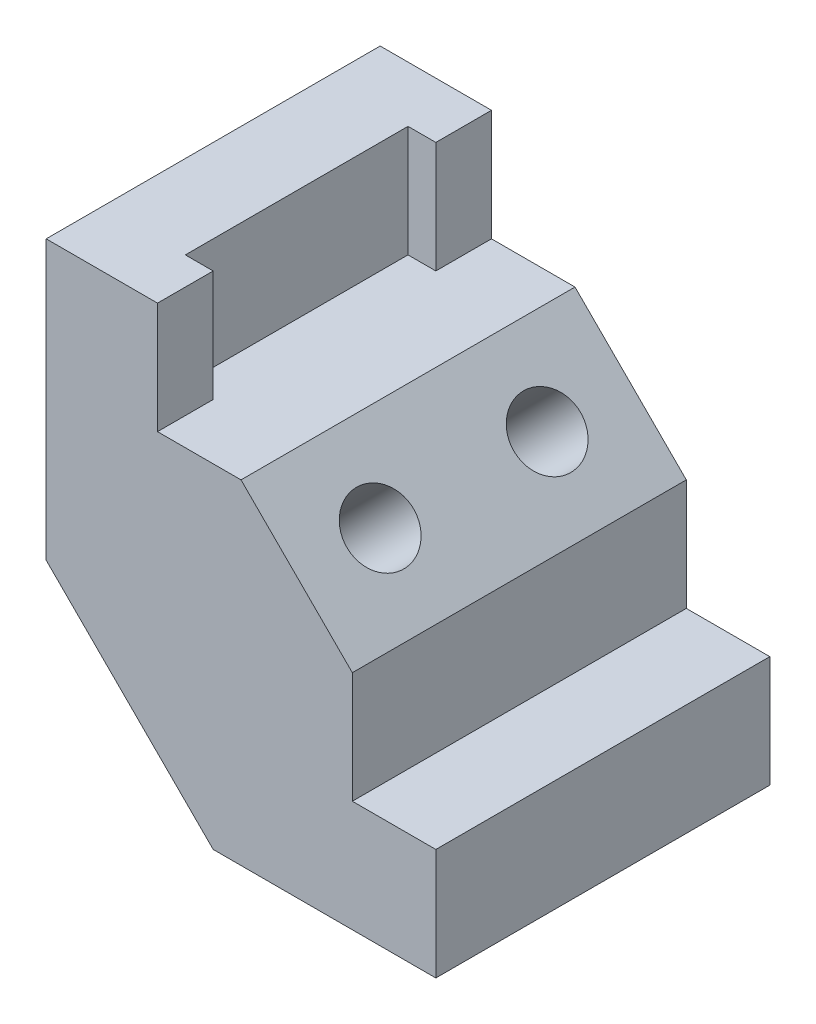
from build123d import *

# Parameters (mm, degrees)
BOSS_EXTRUDE2_DEPTH = 38.1
SKETCH7_W           = 6.35
SKETCH7_H           = 50.8
CUT_EXTRUDE1_DEPTH  = 25.4
SKETCH8_R           = 7.62
CUT_EXTRUDE3_DEPTH  = 53.34


with BuildPart() as part:
    # Sketch3 → Boss-Extrude2 (new, symmetric)
    with BuildSketch(Plane.XY):
        Polygon((0, 18.396289168), (0, -45.103710832), (38.1, -83.203710832), (88.9, -83.203710832), (88.9, -57.803710832), (69.85, -57.803710832), (69.85, -32.403710832), (44.45, -7.003710832), (25.4, -7.003710832), (25.4, 18.396289168), align=None)
    extrude(amount=BOSS_EXTRUDE2_DEPTH, both=True)

    # Sketch7 → Cut-Extrude1 (cut)
    with BuildSketch(Plane(origin=(0, 18.396289168, 0), x_dir=(1, 0, 0), z_dir=(0, 1, 0))):
        with Locations((22.225, 0)):
            Rectangle(SKETCH7_W, SKETCH7_H)
    extrude(amount=-CUT_EXTRUDE1_DEPTH, mode=Mode.SUBTRACT)

    # Sketch8 → Cut-Extrude3 (cut)
    with BuildSketch(Plane(origin=(18.723144584, 18.723144584, 0), x_dir=(0, 0, -1), z_dir=(0.7071067811865487, 0.7071067811865465, 0))):
        with Locations(Location((-19.05, -54.346492331, 0), (0, 0, 90))):
            Circle(SKETCH8_R)
        with Locations(Location((19.05, -54.346492331, 0), (0, 0, 90))):
            Circle(SKETCH8_R)
    extrude(amount=-CUT_EXTRUDE3_DEPTH, mode=Mode.SUBTRACT)


solid = part.part
